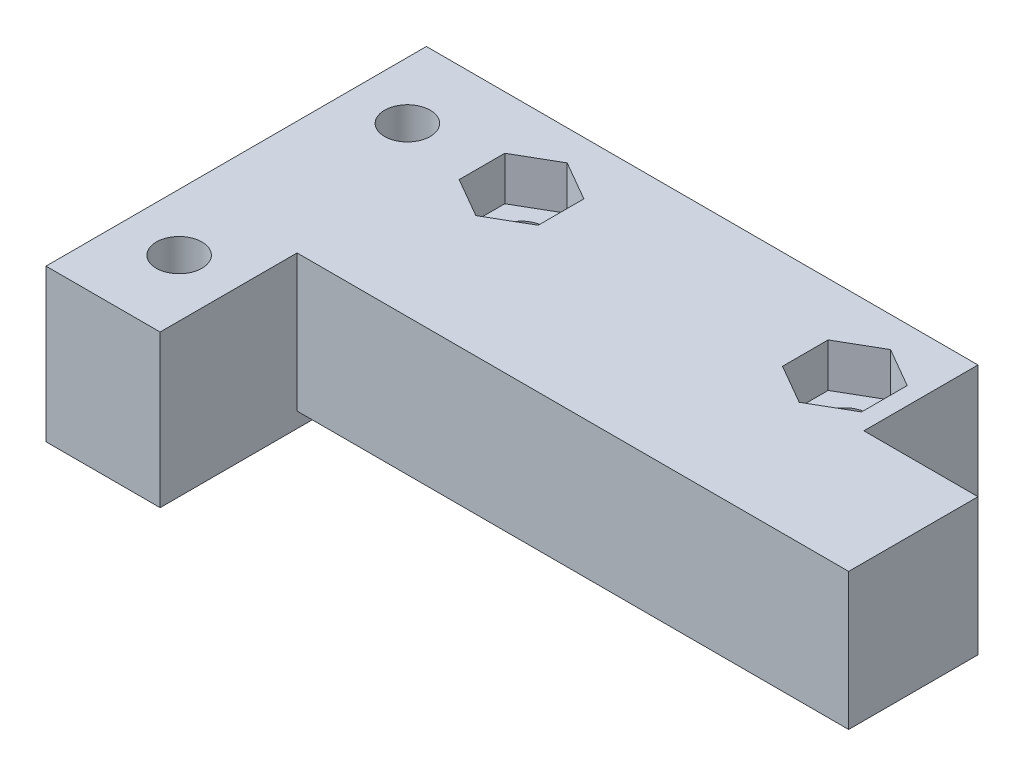
from build123d import *

# Parameters (mm, degrees)
SKETCH_1_W           = 35
SKETCH_1_H           = 20
EXTRUDE_1_DEPTH      = 8
SKETCH_2_W           = 29
SKETCH_2_H           = 14
CUT_EXTRUDE_2_DEPTH  = 0.8
SKETCH_3_W           = 29
SKETCH_3_H           = 7.2
CUT_EXTRUDE_4_DEPTH  = 42.097445176
SKETCH_4_W           = 6
SKETCH_4_H           = 6
CUT_EXTRUDE_5_DEPTH  = 42.097445176
SKETCH_5_R           = 1.2
CUT_EXTRUDE_6_DEPTH  = 42.097445176
CUT_EXTRUDE_START    = 8
CUT_EXTRUDE_8_DEPTH  = 2.3
SKETCH_6_R           = 2.2
CUT_EXTRUDE_10_DEPTH = 2


with BuildPart() as part:
    # 草圖1 → 填料-伸長1 (new body)
    with BuildSketch(Plane(origin=(0, 0, 0), x_dir=(1, 0, 0), z_dir=(0, 1, 0))):
        with Locations((17.5, 10)):
            Rectangle(SKETCH_1_W, SKETCH_1_H)
    extrude(amount=EXTRUDE_1_DEPTH)

    # 草圖2 → 除料-伸長2 (cut)
    with BuildSketch(Plane(origin=(0, 0, 0), x_dir=(1, 0, 0), z_dir=(0, 1, 0))):
        with Locations((20.5, 7)):
            Rectangle(SKETCH_2_W, SKETCH_2_H)
    extrude(amount=CUT_EXTRUDE_2_DEPTH, mode=Mode.SUBTRACT)

    # 草圖3 → 除料-伸長4 (cut, through all)
    with BuildSketch(Plane(origin=(0, 0, 0), x_dir=(1, 0, 0), z_dir=(0, 1, 0))):
        with Locations((20.5, 3.6)):
            Rectangle(SKETCH_3_W, SKETCH_3_H)
    extrude(amount=CUT_EXTRUDE_4_DEPTH, mode=Mode.SUBTRACT)

    # 草圖4 → 除料-伸長5 (cut, through all)
    with BuildSketch(Plane(origin=(0, 0, 0), x_dir=(1, 0, 0), z_dir=(0, 1, 0))):
        with Locations((32, 17)):
            Rectangle(SKETCH_4_W, SKETCH_4_H)
    extrude(amount=CUT_EXTRUDE_5_DEPTH, mode=Mode.SUBTRACT)

    # 草圖5 → 除料-伸長6 (cut, through all)
    with BuildSketch(Plane(origin=(0, 0, 0), x_dir=(1, 0, 0), z_dir=(0, 1, 0))):
        with Locations(Location((3, 16, 0), (0, 0, 270))):
            Circle(SKETCH_5_R)
        with Locations(Location((3, 4, 0), (0, 0, 270))):
            Circle(SKETCH_5_R)
        with Locations(Location((9, 16, 0), (0, 0, 270))):
            Circle(SKETCH_5_R)
        with Locations(Location((26, 16, 0), (0, 0, 270))):
            Circle(SKETCH_5_R)
    extrude(amount=CUT_EXTRUDE_6_DEPTH, mode=Mode.SUBTRACT)

    # 草圖7 → 除料-伸長8 (cut)
    with BuildSketch(Plane(origin=(0, 0, 0), x_dir=(1, 0, 0), z_dir=(0, 1, 0)).offset(CUT_EXTRUDE_START)):
        Polygon((26, 18.4), (23.921539031, 17.2), (23.921539031, 14.8), (26, 13.6), (28.078460969, 14.8), (28.078460969, 17.2), align=None)
        Polygon((9, 18.4), (6.921539031, 17.2), (6.921539031, 14.8), (9, 13.6), (11.078460969, 14.8), (11.078460969, 17.2), align=None)
    extrude(amount=-CUT_EXTRUDE_8_DEPTH, mode=Mode.SUBTRACT)

    # 草圖6 → 除料-伸長10 (cut)
    with BuildSketch(Plane(origin=(0, 0, 0), x_dir=(1, 0, 0), z_dir=(0, 1, 0))):
        with Locations(Location((3, 16, 0), (0, 0, 90))):
            Circle(SKETCH_6_R)
        with Locations(Location((3, 4, 0), (0, 0, 90))):
            Circle(SKETCH_6_R)
    extrude(amount=CUT_EXTRUDE_10_DEPTH, mode=Mode.SUBTRACT)


solid = part.part
